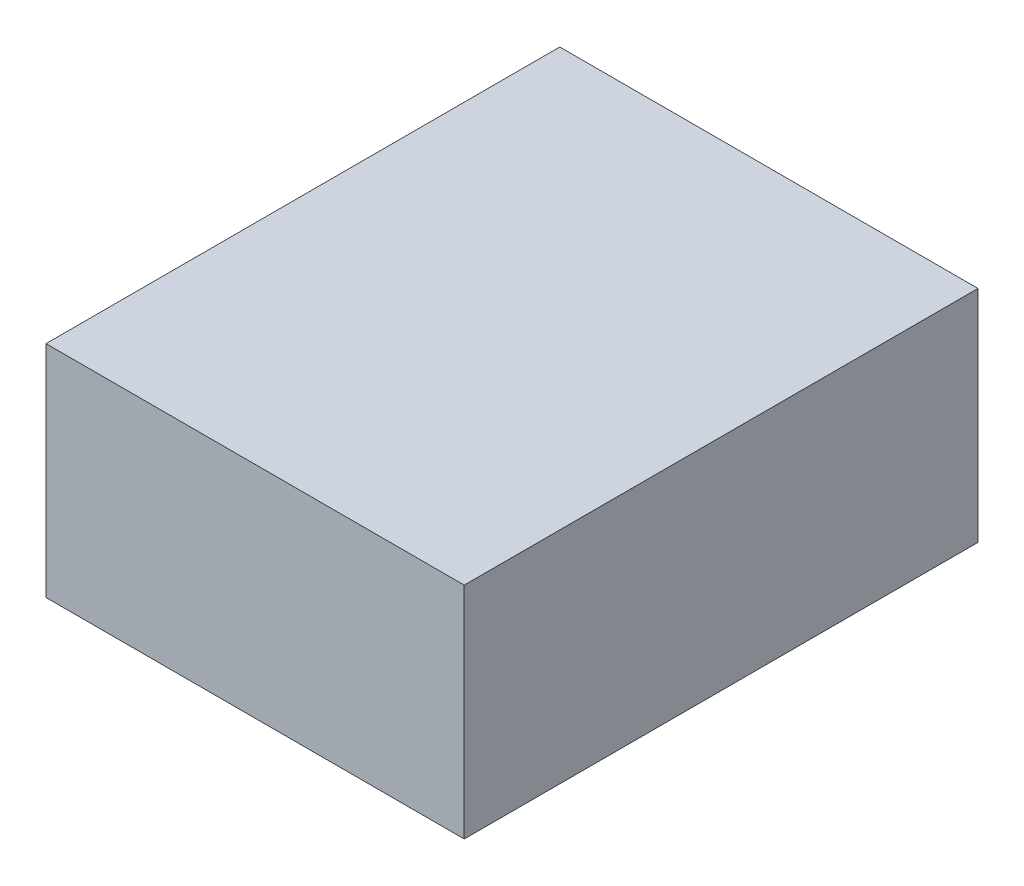
from build123d import *

# Parameters (mm, degrees)
SKIZZE1_W                       = 22.5
SKIZZE1_H                       = 27.64
AUFSATZ_LINEAR_AUSTRAGEN1_DEPTH = 11.83


with BuildPart() as part:
    # Skizze1 → Aufsatz-Linear austragen1 (new body)
    with BuildSketch(Plane(origin=(0, 0, 0), x_dir=(1, 0, 0), z_dir=(0, 1, 0))):
        with Locations((11.25, 13.82)):
            Rectangle(SKIZZE1_W, SKIZZE1_H)
    extrude(amount=AUFSATZ_LINEAR_AUSTRAGEN1_DEPTH)


solid = part.part
